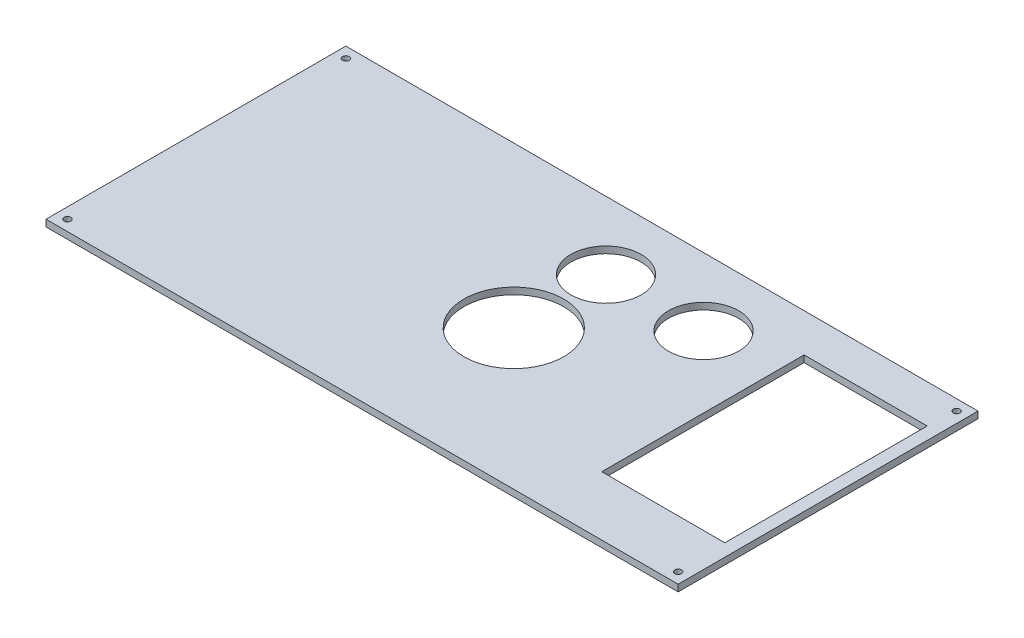
from build123d import *

# Parameters (mm, degrees)
SKETCH2_W               = 235.89
SKETCH2_H               = 111.89
BOSS_EXTRUDE1_DEPTH     = 2.5
SKETCH3_R               = 1.25
CUT_EXTRUDE1_DEPTH      = 131.56460489
CUT_EXTRUDE2_DEPTH      = 131.56460489
CUT_EXTRUDE2_DEPTH_BACK = 131.56460489
SKETCH4_R               = 13.1
SKETCH4_R_2             = 18.65
SKETCH4_W               = 45.9288
SKETCH4_H               = 75.4987


with BuildPart() as part:
    # Sketch2 → Boss-Extrude1 (new body)
    with BuildSketch(Plane(origin=(0, 0, 0), x_dir=(1, 0, 0), z_dir=(0, 1, 0))):
        Rectangle(SKETCH2_W, SKETCH2_H)
    extrude(amount=BOSS_EXTRUDE1_DEPTH)

    # Sketch3 → Cut-Extrude1 (cut, through all)
    with BuildSketch(Plane(origin=(0, 2.5, 0), x_dir=(1, 0, 0), z_dir=(0, 1, 0))):
        with Locations(Location((-113.945, 51.945, 0), (0, 0, 270))):
            Circle(SKETCH3_R)
        with Locations(Location((-113.945, -51.945, 0), (0, 0, 270))):
            Circle(SKETCH3_R)
        with Locations(Location((113.945, -51.945, 0), (0, 0, 270))):
            Circle(SKETCH3_R)
        with Locations(Location((113.945, 51.945, 0), (0, 0, 270))):
            Circle(SKETCH3_R)
    extrude(amount=-CUT_EXTRUDE1_DEPTH, mode=Mode.SUBTRACT)

    # Sketch4 → Cut-Extrude2 (cut, two sides: drawn at the far end of the back side and taken through both)
    with BuildSketch(Plane(origin=(0, 2.5, 0), x_dir=(1, 0, 0), z_dir=(0, 1, 0)).offset(-CUT_EXTRUDE2_DEPTH_BACK)):
        with Locations(Location((40.845, 30.6237, 0), (0, 0, 270))):
            Circle(SKETCH4_R)
        with Locations(Location((4.445, 30.6237, 0), (0, 0, 270))):
            Circle(SKETCH4_R)
        with Locations(Location((4.445, -3.7763, 0), (0, 0, 270))):
            Circle(SKETCH4_R_2)
        with Locations((90.3227, 3.89565)):
            Rectangle(SKETCH4_W, SKETCH4_H)
    extrude(amount=CUT_EXTRUDE2_DEPTH + CUT_EXTRUDE2_DEPTH_BACK, mode=Mode.SUBTRACT)


solid = part.part
